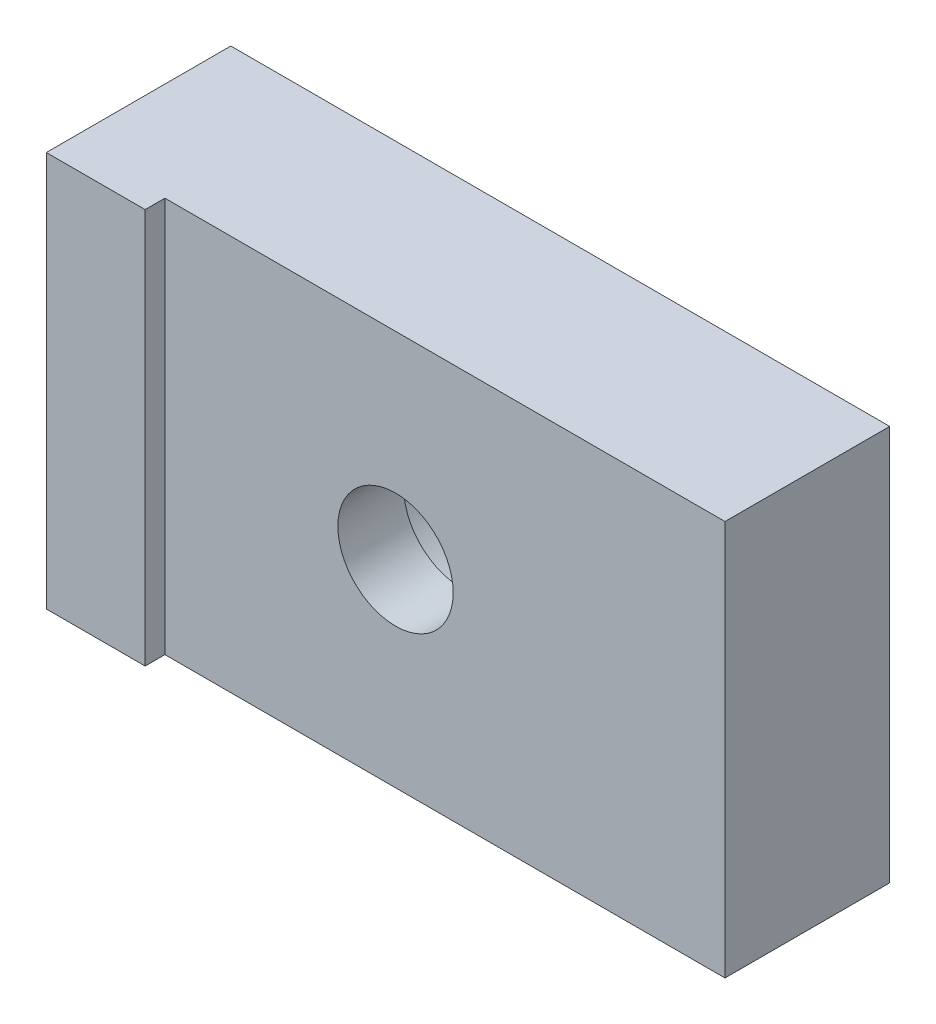
from build123d import *

# Parameters (mm, degrees)
SKETCH1_W           = 20
SKETCH1_H           = 12
SKETCH1_R           = 1.75
BOSS_EXTRUDE1_DEPTH = 5
SKETCH2_W           = 3
SKETCH2_H           = 12
BOSS_EXTRUDE2_DEPTH = 0.6
SKETCH3_R           = 3
CUT_EXTRUDE1_DEPTH  = 3


with BuildPart() as part:
    # Sketch1 → Boss-Extrude1 (new body)
    with BuildSketch(Plane.XY):
        with Locations((10, 6)):
            Rectangle(SKETCH1_W, SKETCH1_H)
        with Locations((10, 6)):
            Circle(SKETCH1_R, mode=Mode.SUBTRACT)
    extrude(amount=BOSS_EXTRUDE1_DEPTH)

    # Sketch2 → Boss-Extrude2 (add)
    with BuildSketch(Plane.XY.offset(5)):
        with Locations((1.5, 6)):
            Rectangle(SKETCH2_W, SKETCH2_H)
    extrude(amount=BOSS_EXTRUDE2_DEPTH)

    # Sketch3 → Cut-Extrude1 (cut)
    with BuildSketch(Plane(origin=(0, 0, 0), x_dir=(-1, 0, 0), z_dir=(0, 0, -1))):
        with Locations((-10, 6)):
            Circle(SKETCH3_R)
    extrude(amount=-CUT_EXTRUDE1_DEPTH, mode=Mode.SUBTRACT)


solid = part.part
